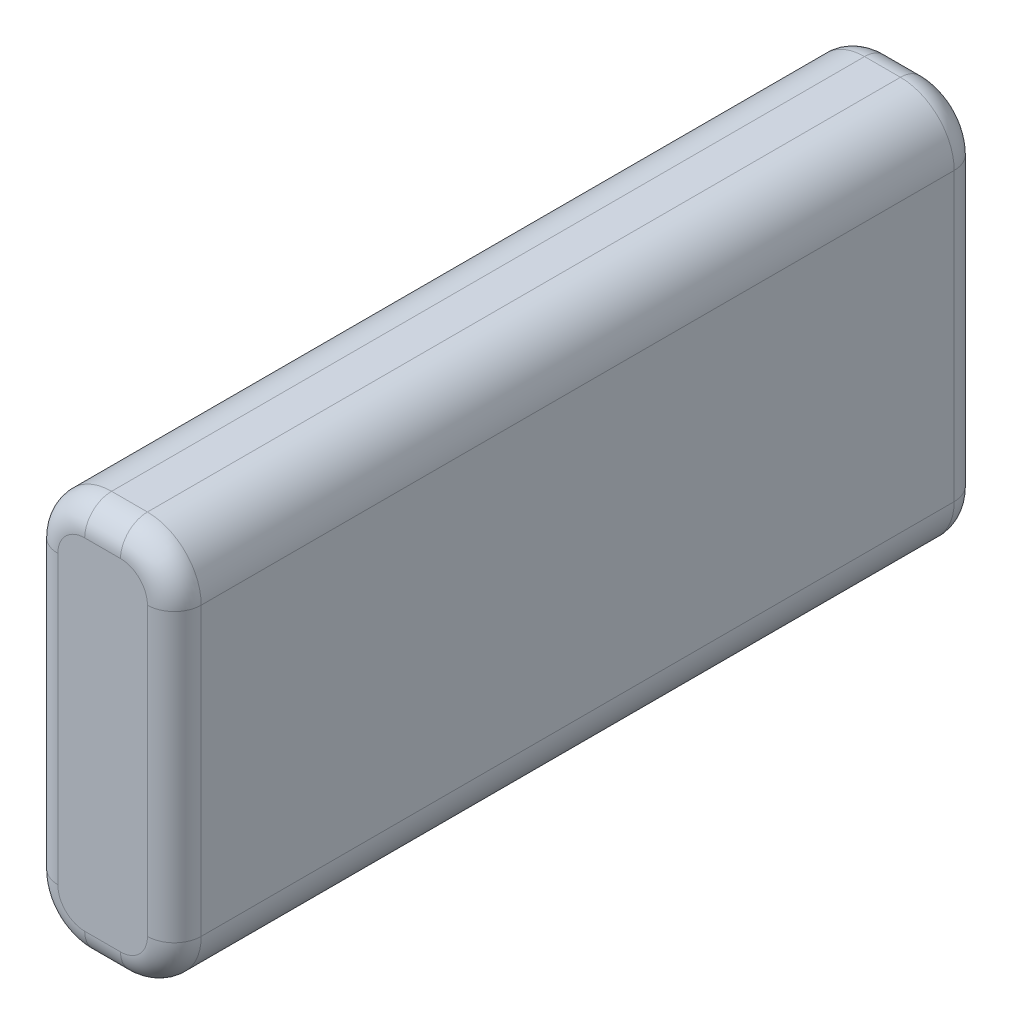
from build123d import *

# Parameters (mm, degrees)
BLOCK_START           = -45
BLOCK_1_DEPTH         = 90
BLOCK_EDGE_FILLET_1_R = 3


with BuildPart() as part:
    # Block sketch 1 → Block 1 (new body)
    with BuildSketch(Plane.XY.offset(BLOCK_START)):
        with BuildLine():
            Line((-2, -22), (2, -22))
            ThreePointArc((2, -22), (6.242640687, -20.242640687), (8, -16))
            Line((8, -16), (8, 16))
            ThreePointArc((8, 16), (6.242640687, 20.242640687), (2, 22))
            Line((2, 22), (-2, 22))
            ThreePointArc((-2, 22), (-6.242640687, 20.242640687), (-8, 16))
            Line((-8, 16), (-8, -16))
            ThreePointArc((-8, -16), (-6.242640687, -20.242640687), (-2, -22))
        make_face()
    extrude(amount=BLOCK_1_DEPTH)

    # Block edge fillet 1
    block_edge_fillet_1_edges = [part.edges().sort_by_distance(p)[0] for p in [
        (8, 0, -45),
        (6.242640687, -20.242640687, -45),
        (0, -22, -45),
        (-6.242640687, -20.242640687, -45),
        (6.242640687, -20.242640687, 45),
        (8, 0, 45),
        (6.242640687, 20.242640687, 45),
        (0, 22, 45),
        (-6.242640687, 20.242640687, 45),
        (-8, 0, 45),
        (-6.242640687, -20.242640687, 45),
        (-8, 0, -45),
        (0, -22, 45),
        (-6.242640687, 20.242640687, -45),
        (0, 22, -45),
        (6.242640687, 20.242640687, -45),
    ]]
    fillet(block_edge_fillet_1_edges, radius=BLOCK_EDGE_FILLET_1_R)


solid = part.part
